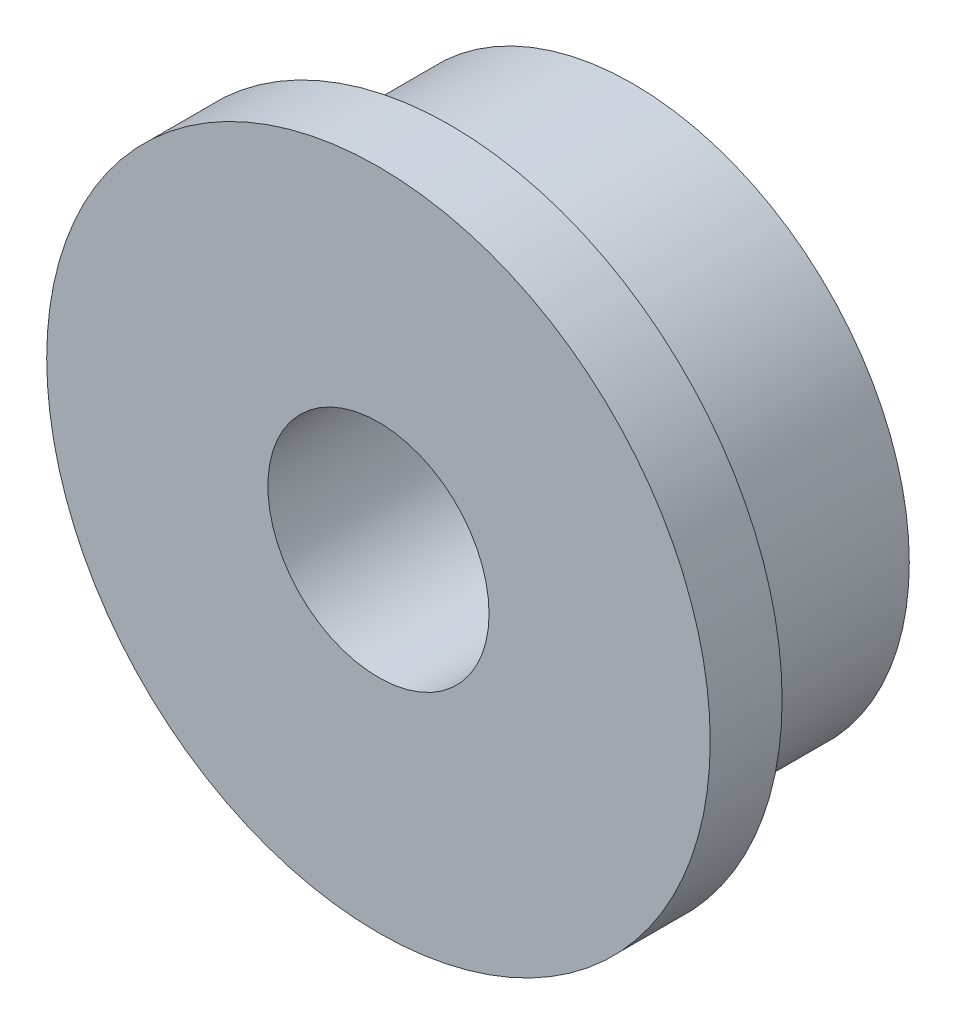
from build123d import *

# Parameters (mm, degrees)
SKETCH1_R           = 2.5
SKETCH1_R_2         = 1
BOSS_EXTRUDE1_DEPTH = 1.65
SKETCH2_R           = 3
SKETCH2_R_2         = 1
BOSS_EXTRUDE2_DEPTH = 0.65


with BuildPart() as part:
    # Sketch1 → Boss-Extrude1 (new body)
    with BuildSketch(Plane.XY):
        Circle(SKETCH1_R)
        Circle(SKETCH1_R_2, mode=Mode.SUBTRACT)
    extrude(amount=BOSS_EXTRUDE1_DEPTH)

    # Sketch2 → Boss-Extrude2 (add)
    with BuildSketch(Plane.XY.offset(1.65)):
        Circle(SKETCH2_R)
        Circle(SKETCH2_R_2, mode=Mode.SUBTRACT)
    extrude(amount=BOSS_EXTRUDE2_DEPTH)


solid = part.part
